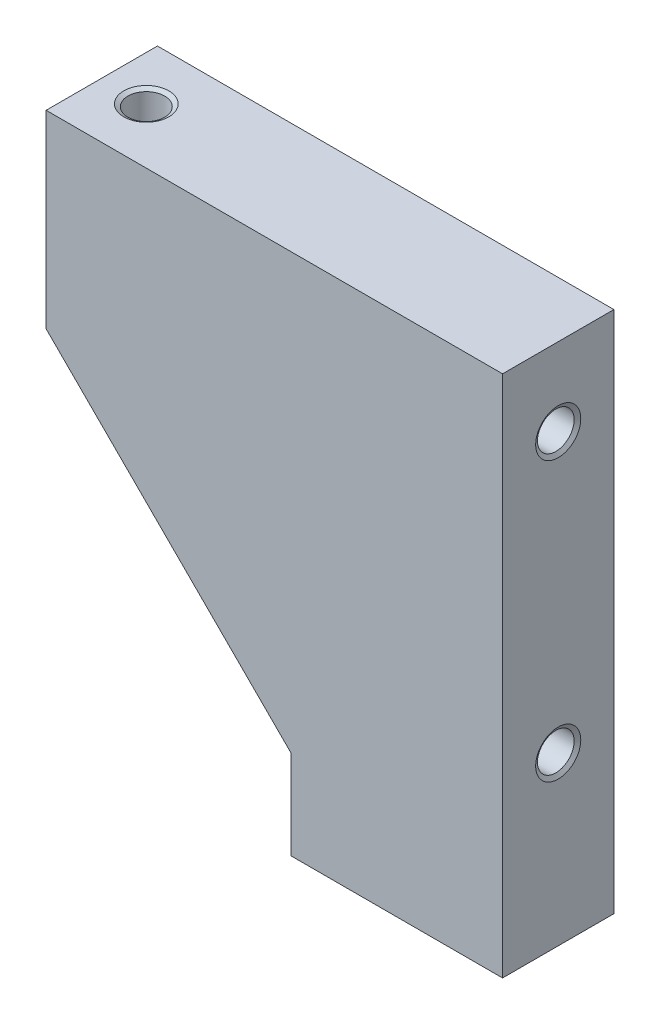
from build123d import *

# Parameters (mm, degrees)
EXTRUDE_1_DEPTH             = 10
HOLE_WIZARD_M41_D           = 3.3
HOLE_WIZARD_M41_DEPTH       = 11.5
HOLE_WIZARD_M41_CSINK_D     = 4.05
HOLE_WIZARD_M41_CSINK_ANGLE = 120
HOLE_WIZARD_M41_TIP         = 0.991420021
HOLE_WIZARD_M42_D           = 3.3
HOLE_WIZARD_M42_DEPTH       = 11.5
HOLE_WIZARD_M42_CSINK_D     = 4.05
HOLE_WIZARD_M42_CSINK_ANGLE = 120
HOLE_WIZARD_M42_TIP         = 0.991420021
HOLE_WIZARD_M43_D           = 3.3
HOLE_WIZARD_M43_DEPTH       = 6
HOLE_WIZARD_M43_CSINK_D     = 4.05
HOLE_WIZARD_M43_CSINK_ANGLE = 120
HOLE_WIZARD_M43_TIP         = 0.991420021


with BuildPart() as part:
    # Эскиз1 → Бобышка-Вытянуть1 (new body)
    with BuildSketch(Plane.XY):
        Polygon((0, 0), (0, 8), (-22, 30), (-22, 47), (19, 47), (19, 0), align=None)
    extrude(amount=EXTRUDE_1_DEPTH)

    # Отверстие обработанное метчиком M41
    with Locations(Plane(origin=(19, 0, 0), x_dir=(0, 0, -1), z_dir=(1, 0, 0))):
        with Locations((-5, 40), (-5, 15)):
            CounterSinkHole(HOLE_WIZARD_M41_D / 2, HOLE_WIZARD_M41_CSINK_D / 2, depth=HOLE_WIZARD_M41_DEPTH, counter_sink_angle=HOLE_WIZARD_M41_CSINK_ANGLE)
            with Locations((0, 0, -(HOLE_WIZARD_M41_DEPTH + HOLE_WIZARD_M41_TIP / 2))):  # 118° drill point
                Cone(0, HOLE_WIZARD_M41_D / 2, HOLE_WIZARD_M41_TIP, mode=Mode.SUBTRACT)

    # Отверстие обработанное метчиком M42
    with Locations(Plane.ZY.offset(22)):
        with Locations((5, 37)):
            CounterSinkHole(HOLE_WIZARD_M42_D / 2, HOLE_WIZARD_M42_CSINK_D / 2, depth=HOLE_WIZARD_M42_DEPTH, counter_sink_angle=HOLE_WIZARD_M42_CSINK_ANGLE)
            with Locations((0, 0, -(HOLE_WIZARD_M42_DEPTH + HOLE_WIZARD_M42_TIP / 2))):  # 118° drill point
                Cone(0, HOLE_WIZARD_M42_D / 2, HOLE_WIZARD_M42_TIP, mode=Mode.SUBTRACT)

    # Отверстие обработанное метчиком M43
    with Locations(Plane(origin=(0, 47, 0), x_dir=(-1, 0, 0), z_dir=(0, 1, 0))):
        with Locations((18, 5)):
            CounterSinkHole(HOLE_WIZARD_M43_D / 2, HOLE_WIZARD_M43_CSINK_D / 2, depth=HOLE_WIZARD_M43_DEPTH, counter_sink_angle=HOLE_WIZARD_M43_CSINK_ANGLE)
            with Locations((0, 0, -(HOLE_WIZARD_M43_DEPTH + HOLE_WIZARD_M43_TIP / 2))):  # 118° drill point
                Cone(0, HOLE_WIZARD_M43_D / 2, HOLE_WIZARD_M43_TIP, mode=Mode.SUBTRACT)


solid = part.part
